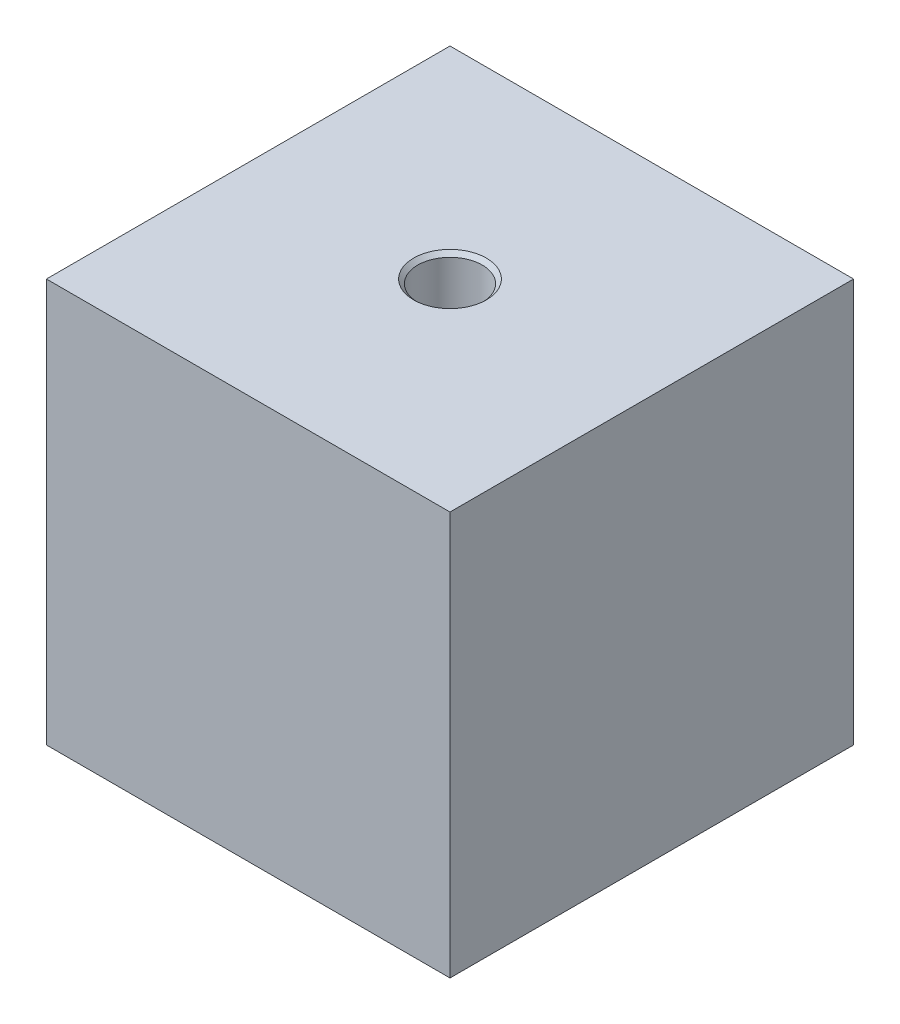
from build123d import *

# Parameters (mm, degrees)
SKICA1_W                 = 50
SKICA1_H                 = 50
P_IDAT_VYSUNUT_M1_DEPTH  = 50
SKICA2_R                 = 2.05
ODEBRAT_VYSUNUT_M1_DEPTH = 50
SKICA3_R                 = 4
ODEBRAT_VYSUNUT_M2_DEPTH = 25
ZKOSEN_1_SIZE            = 0.5
ZKOSEN_2_SIZE            = 0.5


with BuildPart() as part:
    # Skica1 → Přidat vysunutím1 (new body)
    with BuildSketch(Plane.XY):
        Rectangle(SKICA1_W, SKICA1_H)
    extrude(amount=P_IDAT_VYSUNUT_M1_DEPTH)

    # Skica2 → Odebrat vysunutím1 (cut)
    with BuildSketch(Plane(origin=(0, 25, 0), x_dir=(1, 0, 0), z_dir=(0, 1, 0))):
        with Locations(Location((0, -25, 0), (0, 0, 270))):
            Circle(SKICA2_R)
    extrude(amount=-ODEBRAT_VYSUNUT_M1_DEPTH, mode=Mode.SUBTRACT)

    # Skica3 → Odebrat vysunutím2 (cut)
    with BuildSketch(Plane(origin=(0, 25, 0), x_dir=(1, 0, 0), z_dir=(0, 1, 0))):
        with Locations(Location((0, -25, 0), (0, 0, 270))):
            Circle(SKICA3_R)
    extrude(amount=-ODEBRAT_VYSUNUT_M2_DEPTH, mode=Mode.SUBTRACT)

    # Zkosení1
    zkosen_1_edges = [part.edges().sort_by_distance(p)[0] for p in [
        (0, 25, 21),
    ]]
    chamfer(zkosen_1_edges, length=ZKOSEN_1_SIZE)

    # Zkosení2
    zkosen_2_edges = [part.edges().sort_by_distance(p)[0] for p in [
        (0, 0, 22.95),
    ]]
    chamfer(zkosen_2_edges, length=ZKOSEN_2_SIZE)


solid = part.part
